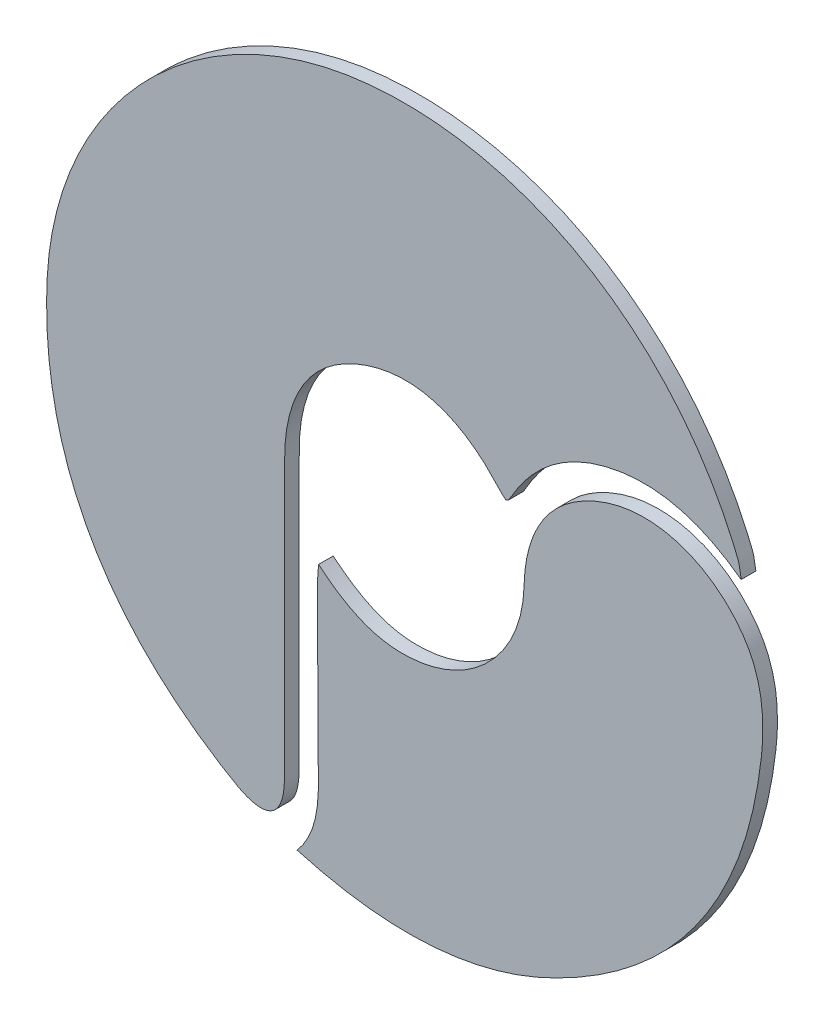
from build123d import *

# Parameters (mm, degrees)
BOSS_EXTRUDE1_DEPTH   = 0.5
BOSS_EXTRUDE1_2_DEPTH = 0.5


with BuildPart() as part:
    # Model → Boss-Extrude1 (new body)
    with BuildSketch(Plane.XY):
        with BuildLine():
            Line((25.301723682, -9.936632718), (25.297928652, -9.940947316))
            add(Edge.make_bspline(
                [(17.278945332, -11.603015037), (17.339549542, -11.570323099), (17.363000973, -11.565467132), (17.372329588, -11.551306166), (17.415599105, -11.485622539), (17.455820244, -11.417867905), (17.495570864, -11.349941595), (18.302664154, -9.970833403), (19.478760053, -9.114769877), (21.06106039, -8.835024951), (22.642403339, -8.55544716), (24.0339185, -9.004231686), (25.297928652, -9.940947316)],
                knots=[11, 11, 11, 11, 12, 12, 12, 13, 13, 13, 14, 14, 14, 15, 15, 15, 15], degree=3))
            add(Edge.make_bspline(
                [(25.301723682, -9.936632718), (25.26261253, -9.747497081), (25.251390942, -9.547121688), (25.180342679, -9.370859904), (22.983992354, -3.921963314), (17.73723015, -1.034316703), (12.275518295, -1.701204852), (6.594142522, -2.394914587), (1.890376936, -7.262384773), (1.632721618, -12.930048299), (1.399324107, -18.064109563), (3.567823815, -21.967425773), (8.019642183, -24.566209123), (9.106695674, -25.200783883), (9.725703364, -24.826772707), (9.726245641, -23.578698409), (9.727607237, -20.443982007), (9.721802967, -17.309252887), (9.72856099, -14.174551018), (9.732971872, -12.128658454), (10.651878657, -10.705882894), (12.360822898, -10.062162093), (14.098081803, -9.407776515), (15.743854876, -9.886557036), (17.091059566, -11.435776667), (17.149480135, -11.502958141), (17.224823012, -11.555423655), (17.278945332, -11.603015037)],
                knots=[2, 2, 2, 2, 3, 3, 3, 4, 4, 4, 5, 5, 5, 6, 6, 6, 7, 7, 7, 8, 8, 8, 9, 9, 9, 10, 10, 10, 11, 11, 11, 11], degree=3))
        make_face()
    extrude(amount=BOSS_EXTRUDE1_DEPTH)


with BuildPart() as body_2:
    # Model → Boss-Extrude1 2 (new body)
    with BuildSketch(Plane.XY):
        with BuildLine():
            add(Edge.make_bspline(
                [(10.888626567, -16.69884896), (10.873519115, -16.915118425), (10.856408781, -17.04397322), (10.856735782, -17.172784415), (10.861564499, -19.075591276), (10.848264636, -20.978777822), (10.88404401, -22.881030598), (10.901588529, -23.813786789), (10.83340516, -24.701378674), (10.159348646, -25.501617657)],
                knots=[7, 7, 7, 7, 8, 8, 8, 9, 9, 9, 10, 10, 10, 10], degree=3))
            add(Edge.make_bspline(
                [(10.159348646, -25.501617657), (13.131977855, -26.351001276), (16.012542621, -26.278178124), (18.731117385, -24.986629026), (22.955606839, -22.979645055), (25.439164074, -19.61186768), (25.978227254, -14.91545837), (26.12465836, -13.639715235), (26.050358253, -12.367958789), (25.179886694, -11.302929733), (24.052717431, -9.923825174), (22.270975472, -9.417988942), (20.636480305, -9.993666257), (18.891760324, -10.608164964), (17.941476873, -11.936474439), (17.897335353, -13.8224471), (17.843765301, -16.111258812), (16.000087511, -17.912900607), (13.726332385, -17.900147563), (12.648125183, -17.894098042), (11.754920687, -17.424348202), (10.888626567, -16.69884896)],
                knots=[0, 0, 0, 0, 1, 1, 1, 2, 2, 2, 3, 3, 3, 4, 4, 4, 5, 5, 5, 6, 6, 6, 7, 7, 7, 7], degree=3))
        make_face()
    extrude(amount=BOSS_EXTRUDE1_2_DEPTH)


solid = Compound([part.part, body_2.part])
